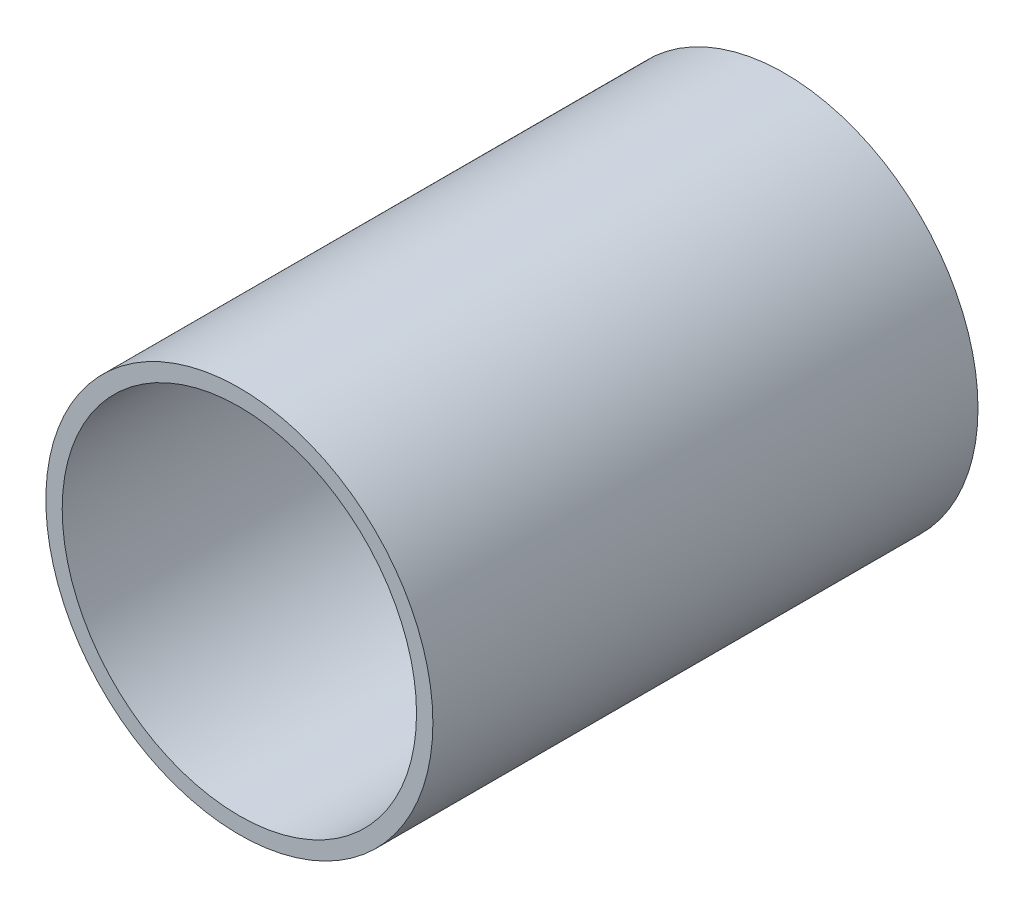
from build123d import *

# Parameters (mm, degrees)
ESQUISSE1_R        = 35.5
ESQUISSE1_R_2      = 32.5
BOSS_EXTRU_1_DEPTH = 100


with BuildPart() as part:
    # Esquisse1 → Boss.-Extru.1 (new body)
    with BuildSketch(Plane.XY):
        Circle(ESQUISSE1_R)
        Circle(ESQUISSE1_R_2, mode=Mode.SUBTRACT)
    extrude(amount=BOSS_EXTRU_1_DEPTH)


solid = part.part
